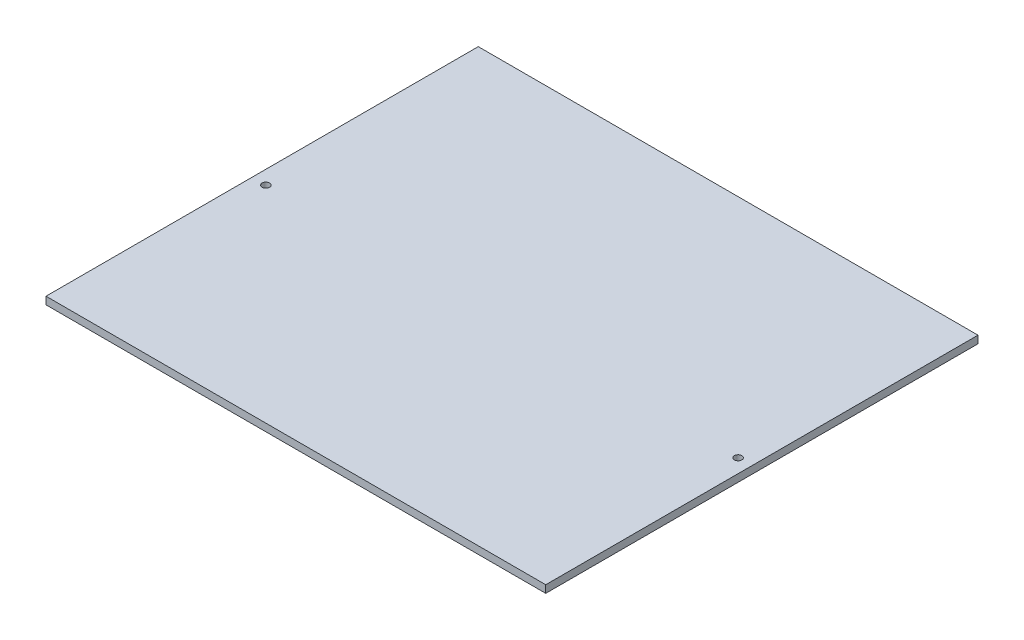
from build123d import *

# Parameters (mm, degrees)
SKETCH1_W           = 200
SKETCH1_H           = 173
BOSS_EXTRUDE1_DEPTH = 3
SKETCH3_R           = 1.5
CUT_EXTRUDE2_DEPTH  = 133.254489527


with BuildPart() as part:
    # Sketch1 → Boss-Extrude1 (new body)
    with BuildSketch(Plane(origin=(0, 0, 0), x_dir=(1, 0, 0), z_dir=(0, 1, 0))):
        Rectangle(SKETCH1_W, SKETCH1_H)
    extrude(amount=BOSS_EXTRUDE1_DEPTH)

    # Sketch3 → Cut-Extrude2 (cut, through all)
    with BuildSketch(Plane(origin=(0, 3, 0), x_dir=(1, 0, 0), z_dir=(0, 1, 0))):
        with Locations(Location((94.5, -4, 0), (0, 0, 270))):
            Circle(SKETCH3_R)
        with Locations(Location((-94.5, -4, 0), (0, 0, 90))):
            Circle(SKETCH3_R)
    extrude(amount=-CUT_EXTRUDE2_DEPTH, mode=Mode.SUBTRACT)


solid = part.part
